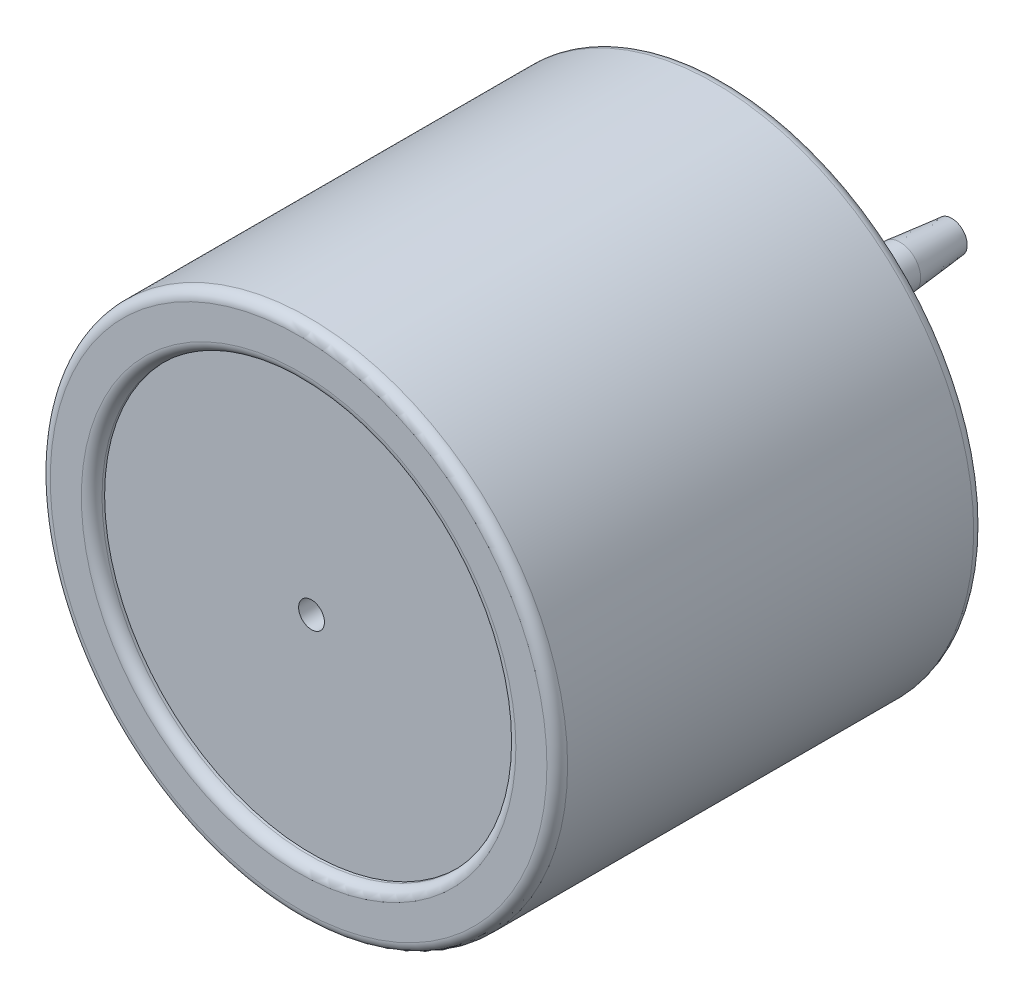
from build123d import *
from OCP.BRepFilletAPI import BRepFilletAPI_MakeChamfer

# Parameters (mm, degrees)
SKETCH_1_R          = 10
EXTRUDE_1_DEPTH     = 16.5
SKETCH_2_R          = 0.5
CUT_EXTRUDE_1_DEPTH = 6
SKETCH_3_R          = 8
CUT_EXTRUDE_2_DEPTH = 0.5
SKETCH_4_R          = 8.75
CUT_EXTRUDE_3_DEPTH = 0.8
SKETCH_5_R          = 0.8
EXTRUDE_2_DEPTH     = 4.85
CHAMFER_1_SIZE      = 2
CHAMFER_1_SIZE2     = 0.2
FILLET_1_R          = 0.4


with BuildPart() as part:
    # Эскиз1 → Бобышка-Вытянуть1 (new body)
    with BuildSketch(Plane.XY):
        Circle(SKETCH_1_R)
    extrude(amount=EXTRUDE_1_DEPTH)

    # Эскиз2 → Вырез-Вытянуть1 (cut)
    with BuildSketch(Plane.XY.offset(16.5)):
        Circle(SKETCH_2_R)
    extrude(amount=-CUT_EXTRUDE_1_DEPTH, mode=Mode.SUBTRACT)

    # Эскиз3 → Вырез-Вытянуть2 (cut)
    with BuildSketch(Plane.XY.offset(16.5)):
        Circle(SKETCH_3_R)
    extrude(amount=-CUT_EXTRUDE_2_DEPTH, mode=Mode.SUBTRACT)

    # Эскиз4 → Вырез-Вытянуть3 (cut)
    with BuildSketch(Plane(origin=(0, 0, 0), x_dir=(-1, 0, 0), z_dir=(0, 0, -1))):
        Circle(SKETCH_4_R)
    extrude(amount=-CUT_EXTRUDE_3_DEPTH, mode=Mode.SUBTRACT)

    # Эскиз5 → Бобышка-Вытянуть2 (add)
    with BuildSketch(Plane(origin=(0, 0, 0.8), x_dir=(-1, 0, 0), z_dir=(0, 0, -1))):
        with Locations((-4.7, 5)):
            Circle(SKETCH_5_R)
        with Locations(Location((4.7, 5, 0), (0, 0, 180))):
            Circle(SKETCH_5_R)
    extrude(amount=EXTRUDE_2_DEPTH)

    # Фаска1: one chamfer whose edges measure the first distance from different faces: ONE call of the kernel's chamfer builder (chamfer() names one face for all edges)
    chamfer_1_edges_1 = [part.edges().sort_by_distance(p)[0] for p in [
        (5.5, 5, -4.05),
    ]]
    chamfer_1_side_1 = [part.faces().sort_by_distance(p)[0] for p in [
        (5.5, 5, -1.625),
    ]]
    chamfer_1_edges_2 = [part.edges().sort_by_distance(p)[0] for p in [
        (-5.5, 5, -4.05),
    ]]
    chamfer_1_side_2 = [part.faces().sort_by_distance(p)[0] for p in [
        (-5.5, 5, -1.625),
    ]]
    chamfer_1 = BRepFilletAPI_MakeChamfer(part.part.solid().wrapped)
    for e in chamfer_1_edges_1:
        chamfer_1.Add(CHAMFER_1_SIZE, CHAMFER_1_SIZE2, e.wrapped, chamfer_1_side_1[0].wrapped)  # the first distance lies on this face
    for e in chamfer_1_edges_2:
        chamfer_1.Add(CHAMFER_1_SIZE, CHAMFER_1_SIZE2, e.wrapped, chamfer_1_side_2[0].wrapped)  # the first distance lies on this face
    add(Compound.cast(chamfer_1.Shape()), mode=Mode.REPLACE)

    # Скругление1
    fillet_1_edges = [part.edges().sort_by_distance(p)[0] for p in [
        (-8, 0, 16.5),
        (-10, 0, 0),
        (8.75, 0, 0),
        (-10, 0, 16.5),
    ]]
    fillet(fillet_1_edges, radius=FILLET_1_R)


solid = part.part
